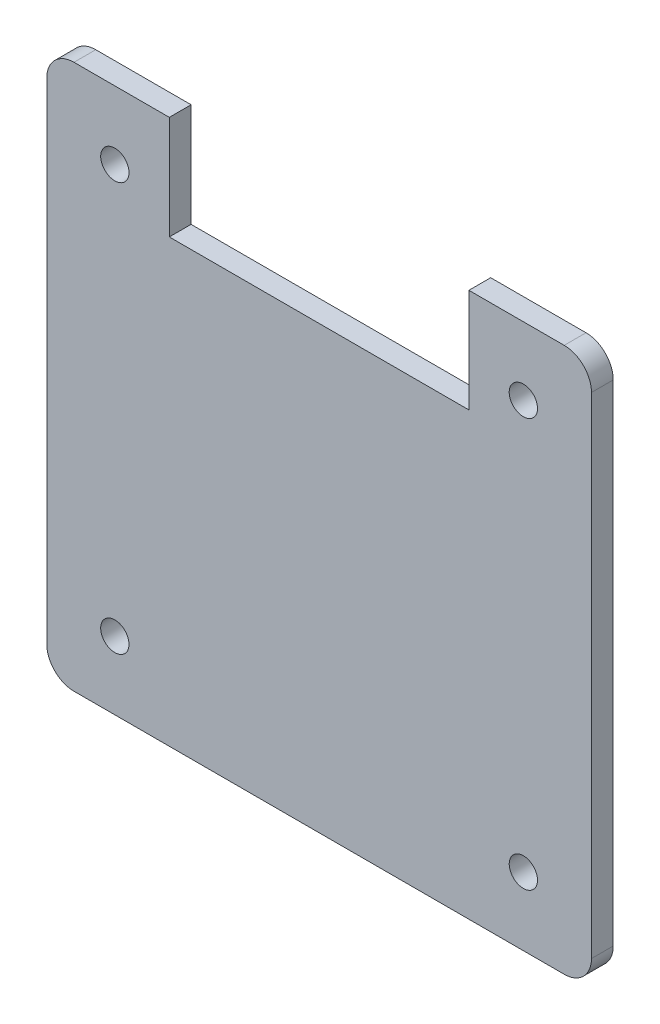
from build123d import *

# Parameters (mm, degrees)
SKETCH1_W           = 100
SKETCH1_H           = 100
BOSS_EXTRUDE1_DEPTH = 4
SKETCH2_R           = 2.6
CUT_EXTRUDE1_DEPTH  = 4
FILLET1_R           = 5
SKETCH3_W           = 55
SKETCH3_H           = 25
CUT_EXTRUDE2_DEPTH  = 4


with BuildPart() as part:
    # Sketch1 → Boss-Extrude1 (new body)
    with BuildSketch(Plane.XY):
        Rectangle(SKETCH1_W, SKETCH1_H)
    extrude(amount=BOSS_EXTRUDE1_DEPTH)

    # Sketch2 → Cut-Extrude1 (cut)
    with BuildSketch(Plane.XY.offset(4)):
        with Locations((-37.5, 37.5)):
            Circle(SKETCH2_R)
        with Locations((-37.5, -37.5)):
            Circle(SKETCH2_R)
        with Locations((37.5, -37.5)):
            Circle(SKETCH2_R)
        with Locations((37.5, 37.5)):
            Circle(SKETCH2_R)
    extrude(amount=-CUT_EXTRUDE1_DEPTH, mode=Mode.SUBTRACT)

    # Fillet1
    fillet1_edges = [part.edges().sort_by_distance(p)[0] for p in [
        (-50, 50, 2),
        (50, 50, 2),
        (50, -50, 2),
        (-50, -50, 2),
    ]]
    fillet(fillet1_edges, radius=FILLET1_R)

    # Sketch3 → Cut-Extrude2 (cut)
    with BuildSketch(Plane(origin=(0, 0, 0), x_dir=(-1, 0, 0), z_dir=(0, 0, -1))):
        with Locations((0, 43.482027076)):
            Rectangle(SKETCH3_W, SKETCH3_H)
    extrude(amount=-CUT_EXTRUDE2_DEPTH, mode=Mode.SUBTRACT)


solid = part.part
